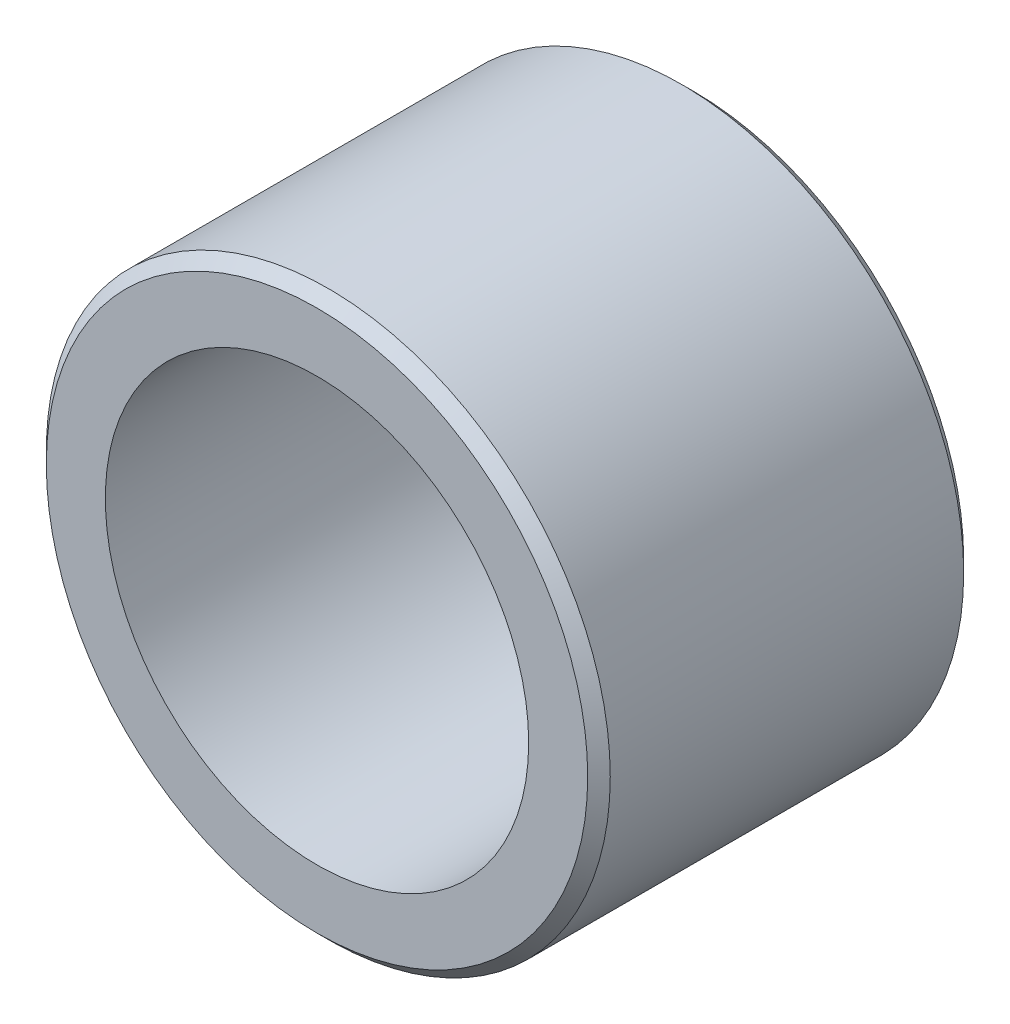
from build123d import *

# Parameters (mm, degrees)
SKETCH1_R           = 9.525
SKETCH1_R_2         = 7.1501
BOSS_EXTRUDE1_DEPTH = 6.35
CHAMFER1_SIZE       = 0.381


with BuildPart() as part:
    # Sketch1 → Boss-Extrude1 (new, symmetric)
    with BuildSketch(Plane.XY):
        Circle(SKETCH1_R)
        Circle(SKETCH1_R_2, mode=Mode.SUBTRACT)
    extrude(amount=BOSS_EXTRUDE1_DEPTH, both=True)

    # Chamfer1
    chamfer1_edges = [part.edges().sort_by_distance(p)[0] for p in [
        (-9.525, 0, -6.35),
        (-9.525, 0, 6.35),
    ]]
    chamfer(chamfer1_edges, length=CHAMFER1_SIZE)


solid = part.part
